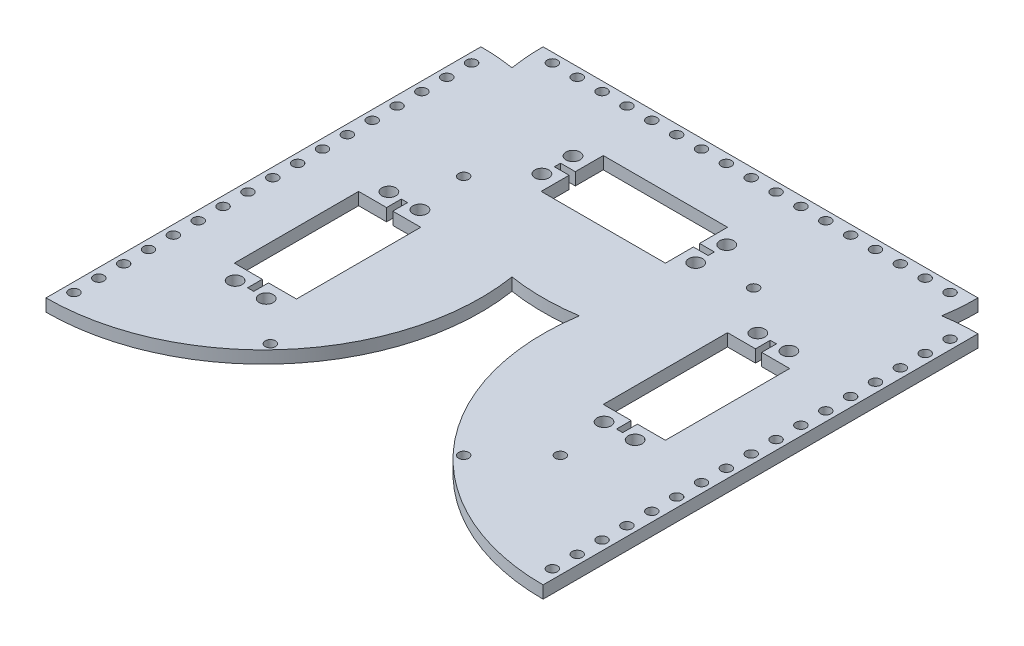
from build123d import *

# Parameters (mm, degrees)
EXTRUDE_1_DEPTH      = 4
CUT_EXTRUDE_1_DEPTH  = 10
SKETCH_3_R           = 2.25
CUT_EXTRUDE_2_DEPTH  = 10
SKETCH_4_R           = 1.65
CUT_EXTRUDE_3_DEPTH  = 10
EXTRUDE_START        = -4
EXTRUDE_2_DEPTH      = 4
SKETCH_6_R           = 1.65
CUT_EXTRUDE_4_DEPTH  = 4
SKETCH_7_W           = 40
SKETCH_7_H           = 10
CUT_EXTRUDE_5_DEPTH  = 4
EXTRUDE_4_DEPTH      = 4
SKETCH_9_R           = 1.65
SKETCH_9_R_2         = 2.25
SKETCH_9_W           = 20
SKETCH_9_H           = 40
EXTRUDE_7_DEPTH      = 4
CUT_EXTRUDE_START    = -4
SKETCH_10_R          = 2.25
SKETCH_10_W          = 20
SKETCH_10_H          = 40
CUT_EXTRUDE_6_DEPTH  = 4
SKETCH_11_W          = 4.75
SKETCH_11_H          = 2
SKETCH_11_W_2        = 2
SKETCH_11_H_2        = 4.75
CUT_EXTRUDE_9_DEPTH  = 10
SKETCH_12_R          = 1.65
CUT_EXTRUDE_10_DEPTH = 10


with BuildPart() as part:
    # 草图1 → 凸台-拉伸1 (new body)
    with BuildSketch(Plane(origin=(0, 0, 0), x_dir=(1, 0, 0), z_dir=(0, 1, 0))):
        with BuildLine():
            Line((-50, 0), (50, 0))
            ThreePointArc((50, 0), (0, -50), (-50, 0))
        make_face()
    extrude(amount=EXTRUDE_1_DEPTH)

    # 草图2 → 切除-拉伸1 (cut)
    with BuildSketch(Plane(origin=(0, 4, 0), x_dir=(1, 0, 0), z_dir=(0, 1, 0))):
        Polygon((0, -10.623043888), (10, -10.623043888), (10, -30.623043888), (-30, -30.623043888), (-30, -10.623043888), align=None)
    extrude(amount=-CUT_EXTRUDE_1_DEPTH, mode=Mode.SUBTRACT)

    # 草图3 → 切除-拉伸2 (cut)
    with BuildSketch(Plane(origin=(0, 4, 0), x_dir=(1, 0, 0), z_dir=(0, 1, 0))):
        with Locations(Location((-34.75, -15.623043888, 0), (0, 0, 270))):
            Circle(SKETCH_3_R)
        with Locations(Location((-34.75, -25.623043888, 0), (0, 0, 270))):
            Circle(SKETCH_3_R)
        with Locations(Location((14.75, -25.623043888, 0), (0, 0, 90))):
            Circle(SKETCH_3_R)
        with Locations(Location((14.75, -15.623043888, 0), (0, 0, 90))):
            Circle(SKETCH_3_R)
    extrude(amount=-CUT_EXTRUDE_2_DEPTH, mode=Mode.SUBTRACT)

    # 草图4 → 切除-拉伸3 (cut)
    with BuildSketch(Plane(origin=(0, 4, 0), x_dir=(1, 0, 0), z_dir=(0, 1, 0))):
        with Locations(Location((0, -3, 0), (0, 0, 270))):
            Circle(SKETCH_4_R)
        with Locations(Location((8, -3, 0), (0, 0, 270))):
            Circle(SKETCH_4_R)
        with Locations(Location((16, -3, 0), (0, 0, 270))):
            Circle(SKETCH_4_R)
        with Locations(Location((24, -3, 0), (0, 0, 270))):
            Circle(SKETCH_4_R)
        with Locations(Location((32, -3, 0), (0, 0, 270))):
            Circle(SKETCH_4_R)
        with Locations(Location((40, -3, 0), (0, 0, 270))):
            Circle(SKETCH_4_R)
        with Locations(Location((-40, -3, 0), (0, 0, 90))):
            Circle(SKETCH_4_R)
        with Locations(Location((-32, -3, 0), (0, 0, 90))):
            Circle(SKETCH_4_R)
        with Locations(Location((-24, -3, 0), (0, 0, 90))):
            Circle(SKETCH_4_R)
        with Locations(Location((-16, -3, 0), (0, 0, 90))):
            Circle(SKETCH_4_R)
        with Locations(Location((-8, -3, 0), (0, 0, 90))):
            Circle(SKETCH_4_R)
    extrude(amount=-CUT_EXTRUDE_3_DEPTH, mode=Mode.SUBTRACT)

    # 草图5 → 凸台-拉伸2 (add)
    with BuildSketch(Plane(origin=(0, 4, 0), x_dir=(1, 0, 0), z_dir=(0, 1, 0)).offset(EXTRUDE_START)):
        with BuildLine():
            Line((-50, 0), (-70, 0))
            ThreePointArc((-70, 0), (0, -70), (70, 0))
            Line((70, 0), (50, 0))
            ThreePointArc((50, 0), (0, -50), (-50, 0))
        make_face()
    extrude(amount=EXTRUDE_2_DEPTH)

    # 草图6 → 切除-拉伸4 (cut)
    with BuildSketch(Plane(origin=(0, 4, 0), x_dir=(1, 0, 0), z_dir=(0, 1, 0))):
        with Locations(Location((0, -3, 0), (0, 0, 270))):
            Circle(SKETCH_6_R)
        with Locations(Location((8, -3, 0), (0, 0, 270))):
            Circle(SKETCH_6_R)
        with Locations(Location((16, -3, 0), (0, 0, 270))):
            Circle(SKETCH_6_R)
        with Locations(Location((24, -3, 0), (0, 0, 270))):
            Circle(SKETCH_6_R)
        with Locations(Location((32, -3, 0), (0, 0, 270))):
            Circle(SKETCH_6_R)
        with Locations(Location((40, -3, 0), (0, 0, 270))):
            Circle(SKETCH_6_R)
        with Locations(Location((48, -3, 0), (0, 0, 270))):
            Circle(SKETCH_6_R)
        with Locations(Location((56, -3, 0), (0, 0, 270))):
            Circle(SKETCH_6_R)
        with Locations(Location((64, -3, 0), (0, 0, 270))):
            Circle(SKETCH_6_R)
        with Locations(Location((-8, -3, 0), (0, 0, 90))):
            Circle(SKETCH_6_R)
        with Locations(Location((-16, -3, 0), (0, 0, 90))):
            Circle(SKETCH_6_R)
        with Locations(Location((-24, -3, 0), (0, 0, 90))):
            Circle(SKETCH_6_R)
        with Locations(Location((-32, -3, 0), (0, 0, 90))):
            Circle(SKETCH_6_R)
        with Locations(Location((-40, -3, 0), (0, 0, 90))):
            Circle(SKETCH_6_R)
        with Locations(Location((-48, -3, 0), (0, 0, 270))):
            Circle(SKETCH_6_R)
        with Locations(Location((-56, -3, 0), (0, 0, 270))):
            Circle(SKETCH_6_R)
        with Locations(Location((-64, -3, 0), (0, 0, 270))):
            Circle(SKETCH_6_R)
    extrude(amount=-CUT_EXTRUDE_4_DEPTH, mode=Mode.SUBTRACT)

    # 草图7 → 切除-拉伸5 (cut)
    with BuildSketch(Plane(origin=(0, 4, 0), x_dir=(1, 0, 0), z_dir=(0, 1, 0))):
        with Locations((-10, -25.623043888)):
            Rectangle(SKETCH_7_W, SKETCH_7_H)
        with Locations((-10, -35.623043888)):
            Rectangle(SKETCH_7_W, SKETCH_7_H)
        with BuildLine():
            ThreePointArc((17, -35.623043888), (16.340990258, -34.03205363), (14.75, -33.373043888))
            ThreePointArc((14.75, -33.373043888), (13.159009742, -37.214034146), (17, -35.623043888))
        make_face()
        with BuildLine():
            ThreePointArc((-32.5, -35.623043888), (-33.159009742, -34.03205363), (-34.75, -33.373043888))
            ThreePointArc((-34.75, -33.373043888), (-36.340990258, -37.214034146), (-32.5, -35.623043888))
        make_face()
    extrude(amount=-CUT_EXTRUDE_5_DEPTH, mode=Mode.SUBTRACT)

    # 草图8 → 凸台-拉伸4 (add)
    with BuildSketch(Plane(origin=(0, 4, 0), x_dir=(1, 0, 0), z_dir=(0, 1, 0))):
        Polygon((-41.554882874, -20.623043888), (14.75, -20.623043888), (21.040870392, -20.623043888), (21.040870392, -8.98726117), (-41.554882874, -8.5063719), align=None)
    extrude(amount=-EXTRUDE_4_DEPTH)

    # 草图9 → 凸台-拉伸7 (add)
    # profile 1 of 2: a face of its own
    with BuildSketch(Plane(origin=(0, 4, 0), x_dir=(1, 0, 0), z_dir=(0, 1, 0)).offset(EXTRUDE_START)):
        with BuildLine():
            ThreePointArc((-80, -150), (-26.806171238, -125.50183053), (-10.845240526, -69.154759474))
            ThreePointArc((-10.845240526, -69.154759474), (-49.497474683, -49.497474683), (-69.154759474, -10.845240526))
            ThreePointArc((-69.154759474, -10.845240526), (-74.560935889, -10.211630041), (-80, -10))
            Line((-80, -10), (-80, -150))
        make_face()
        with Locations(Location((-77, -144, 0), (0, 0, 270))):
            Circle(SKETCH_9_R, mode=Mode.SUBTRACT)
        with Locations(Location((-77, -136, 0), (0, 0, 270))):
            Circle(SKETCH_9_R, mode=Mode.SUBTRACT)
        with Locations(Location((-77, -128, 0), (0, 0, 270))):
            Circle(SKETCH_9_R, mode=Mode.SUBTRACT)
        with Locations(Location((-77, -120, 0), (0, 0, 270))):
            Circle(SKETCH_9_R, mode=Mode.SUBTRACT)
        with Locations(Location((-54.376956112, -114.75, 0), (0, 0, 270))):
            Circle(SKETCH_9_R_2, mode=Mode.SUBTRACT)
        with Locations(Location((-44.376956112, -114.75, 0), (0, 0, 270))):
            Circle(SKETCH_9_R_2, mode=Mode.SUBTRACT)
        with Locations(Location((-77, -112, 0), (0, 0, 270))):
            Circle(SKETCH_9_R, mode=Mode.SUBTRACT)
        with Locations(Location((-77, -104, 0), (0, 0, 270))):
            Circle(SKETCH_9_R, mode=Mode.SUBTRACT)
        with Locations(Location((-77, -96, 0), (0, 0, 270))):
            Circle(SKETCH_9_R, mode=Mode.SUBTRACT)
        with Locations(Location((-77, -88, 0), (0, 0, 270))):
            Circle(SKETCH_9_R, mode=Mode.SUBTRACT)
        with Locations(Location((-77, -80, 0), (0, 0, 270))):
            Circle(SKETCH_9_R, mode=Mode.SUBTRACT)
        with Locations((-49.376956112, -90)):
            Rectangle(SKETCH_9_W, SKETCH_9_H, mode=Mode.SUBTRACT)
        with Locations(Location((-77, -72, 0), (0, 0, 270))):
            Circle(SKETCH_9_R, mode=Mode.SUBTRACT)
        with Locations(Location((-77, -64, 0), (0, 0, 270))):
            Circle(SKETCH_9_R, mode=Mode.SUBTRACT)
        with Locations(Location((-54.376956112, -65.25, 0), (0, 0, 270))):
            Circle(SKETCH_9_R_2, mode=Mode.SUBTRACT)
        with Locations(Location((-44.376956112, -65.25, 0), (0, 0, 270))):
            Circle(SKETCH_9_R_2, mode=Mode.SUBTRACT)
        with Locations(Location((-77, -56, 0), (0, 0, 270))):
            Circle(SKETCH_9_R, mode=Mode.SUBTRACT)
        with Locations(Location((-77, -48, 0), (0, 0, 270))):
            Circle(SKETCH_9_R, mode=Mode.SUBTRACT)
        with Locations(Location((-77, -40, 0), (0, 0, 270))):
            Circle(SKETCH_9_R, mode=Mode.SUBTRACT)
        with Locations(Location((-77, -32, 0), (0, 0, 270))):
            Circle(SKETCH_9_R, mode=Mode.SUBTRACT)
        with Locations(Location((-77, -24, 0), (0, 0, 270))):
            Circle(SKETCH_9_R, mode=Mode.SUBTRACT)
        with Locations(Location((-77, -16, 0), (0, 0, 270))):
            Circle(SKETCH_9_R, mode=Mode.SUBTRACT)
    # profile 2 of 2: a face of its own
    with BuildSketch(Plane(origin=(0, 4, 0), x_dir=(1, 0, 0), z_dir=(0, 1, 0)).offset(EXTRUDE_START)):
        with BuildLine():
            ThreePointArc((39.376956112, -57.874479068), (25.73671386, -65.097016519), (10.845240526, -69.154759474))
            ThreePointArc((10.845240526, -69.154759474), (26.806171238, -125.50183053), (80, -150))
            Line((80, -150), (80, -80))
            Line((80, -80), (80, -10))
            ThreePointArc((80, -10), (74.560935889, -10.211630041), (69.154759474, -10.845240526))
            ThreePointArc((69.154759474, -10.845240526), (64.206635613, -27.883829422), (55.133596526, -43.131039103))
            ThreePointArc((55.133596526, -43.131039103), (56.106456706, -46.689210789), (52.430746339, -46.379056031))
            ThreePointArc((52.430746339, -46.379056031), (50.742579289, -48.220230683), (48.989794856, -50))
            Line((48.989794856, -50), (59.376956112, -50))
            Line((59.376956112, -50), (59.376956112, -90))
            Line((59.376956112, -90), (39.376956112, -90))
            Line((39.376956112, -90), (39.376956112, -57.874479068))
        make_face()
        with Locations(Location((77, -144, 0), (0, 0, 270))):
            Circle(SKETCH_9_R, mode=Mode.SUBTRACT)
        with Locations(Location((77, -136, 0), (0, 0, 270))):
            Circle(SKETCH_9_R, mode=Mode.SUBTRACT)
        with Locations(Location((77, -128, 0), (0, 0, 270))):
            Circle(SKETCH_9_R, mode=Mode.SUBTRACT)
        with Locations(Location((77, -120, 0), (0, 0, 270))):
            Circle(SKETCH_9_R, mode=Mode.SUBTRACT)
        with Locations(Location((44.376956112, -94.75, 0), (0, 0, 270))):
            Circle(SKETCH_9_R_2, mode=Mode.SUBTRACT)
        with Locations(Location((54.376956112, -94.75, 0), (0, 0, 270))):
            Circle(SKETCH_9_R_2, mode=Mode.SUBTRACT)
        with Locations(Location((77, -112, 0), (0, 0, 270))):
            Circle(SKETCH_9_R, mode=Mode.SUBTRACT)
        with Locations(Location((77, -104, 0), (0, 0, 270))):
            Circle(SKETCH_9_R, mode=Mode.SUBTRACT)
        with Locations(Location((77, -96, 0), (0, 0, 270))):
            Circle(SKETCH_9_R, mode=Mode.SUBTRACT)
        with Locations(Location((77, -88, 0), (0, 0, 270))):
            Circle(SKETCH_9_R, mode=Mode.SUBTRACT)
        with Locations(Location((77, -80, 0), (0, 0, 270))):
            Circle(SKETCH_9_R, mode=Mode.SUBTRACT)
        with Locations(Location((77, -72, 0), (0, 0, 270))):
            Circle(SKETCH_9_R, mode=Mode.SUBTRACT)
        with Locations(Location((77, -64, 0), (0, 0, 270))):
            Circle(SKETCH_9_R, mode=Mode.SUBTRACT)
        with Locations(Location((77, -56, 0), (0, 0, 270))):
            Circle(SKETCH_9_R, mode=Mode.SUBTRACT)
        with Locations(Location((77, -48, 0), (0, 0, 270))):
            Circle(SKETCH_9_R, mode=Mode.SUBTRACT)
        with Locations(Location((77, -40, 0), (0, 0, 270))):
            Circle(SKETCH_9_R, mode=Mode.SUBTRACT)
        with Locations(Location((77, -32, 0), (0, 0, 270))):
            Circle(SKETCH_9_R, mode=Mode.SUBTRACT)
        with Locations(Location((77, -24, 0), (0, 0, 270))):
            Circle(SKETCH_9_R, mode=Mode.SUBTRACT)
        with Locations(Location((77, -16, 0), (0, 0, 270))):
            Circle(SKETCH_9_R, mode=Mode.SUBTRACT)
    extrude(amount=EXTRUDE_7_DEPTH)

    # 草图10 → 切除-拉伸6 (cut)
    with BuildSketch(Plane(origin=(0, 4, 0), x_dir=(1, 0, 0), z_dir=(0, 1, 0)).offset(CUT_EXTRUDE_START)):
        with Locations(Location((54.376956112, -45.25, 0), (0, 0, 270))):
            Circle(SKETCH_10_R)
        with Locations(Location((44.376956112, -45.25, 0), (0, 0, 270))):
            Circle(SKETCH_10_R)
        with Locations((49.376956112, -70)):
            Rectangle(SKETCH_10_W, SKETCH_10_H)
    extrude(amount=CUT_EXTRUDE_6_DEPTH, mode=Mode.SUBTRACT)

    # 草图11 → 切除-拉伸9 (cut)
    with BuildSketch(Plane.XZ):
        with Locations((-32.375, 30.623043888)):
            Rectangle(SKETCH_11_W, SKETCH_11_H)
        with Locations((12.375, 30.623043888)):
            Rectangle(SKETCH_11_W, SKETCH_11_H)
        with Locations((49.376956112, 47.625)):
            Rectangle(SKETCH_11_W_2, SKETCH_11_H_2)
        with Locations((49.376956112, 92.375)):
            Rectangle(SKETCH_11_W_2, SKETCH_11_H_2)
        with Locations((-49.376956112, 67.625)):
            Rectangle(SKETCH_11_W_2, SKETCH_11_H_2)
        with Locations((-49.376956112, 112.375)):
            Rectangle(SKETCH_11_W_2, SKETCH_11_H_2)
    extrude(amount=-CUT_EXTRUDE_9_DEPTH, mode=Mode.SUBTRACT)

    # 草图12 → 切除-拉伸10 (cut)
    with BuildSketch(Plane.XZ):
        with Locations(Location((-46.669047558, 48.887301628, 0), (0, 0, 270))):
            Circle(SKETCH_12_R)
        with Locations(Location((-31.112698372, 126.669047558, 0), (0, 0, 270))):
            Circle(SKETCH_12_R)
        with Locations(Location((31.112698372, 126.669047558, 0), (0, 0, 270))):
            Circle(SKETCH_12_R)
        with Locations(Location((46.669047558, 111.112698372, 0), (0, 0, 270))):
            Circle(SKETCH_12_R)
        with Locations(Location((31.112698372, 33.330952442, 0), (0, 0, 270))):
            Circle(SKETCH_12_R)
    extrude(amount=-CUT_EXTRUDE_10_DEPTH, mode=Mode.SUBTRACT)


solid = part.part
